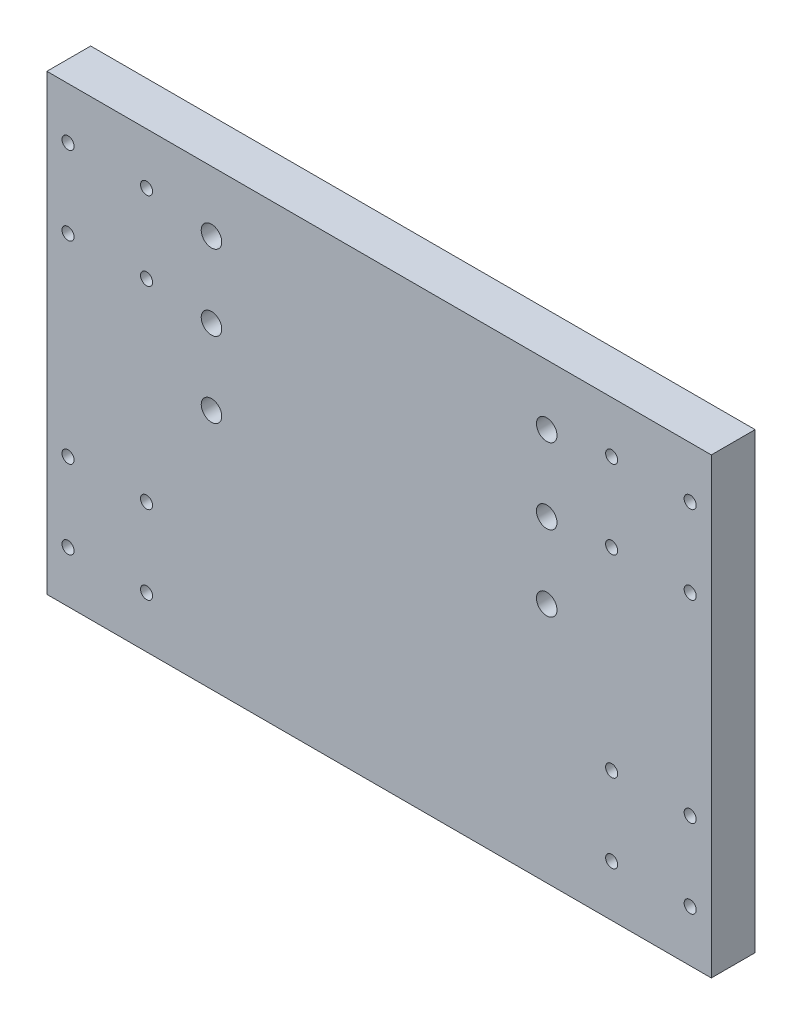
from build123d import *

# Parameters (mm, degrees)
ESQUISSE1_W                  = 220
ESQUISSE1_H                  = 150
BOSS_EXTRU_1_DEPTH           = 14.5
ENL_V_MAT_EXTRU_1_DEPTH      = 267.665052078
ENL_V_MAT_EXTRU_1_DEPTH_BACK = 267.665052078
ESQUISSE2_R                  = 2
ESQUISSE3_R                  = 4
ENL_V_MAT_EXTRU_2_DEPTH      = 4
ENL_V_MAT_EXTRU_3_DEPTH      = 267.665052078
ENL_V_MAT_EXTRU_3_DEPTH_BACK = 267.665052078
ESQUISSE4_R                  = 3.4


with BuildPart() as part:
    # Esquisse1 → Boss.-Extru.1 (new body)
    with BuildSketch(Plane.XY):
        with Locations((110, 75)):
            Rectangle(ESQUISSE1_W, ESQUISSE1_H)
    extrude(amount=BOSS_EXTRU_1_DEPTH)

    # Esquisse2 → Enlèv. mat.-Extru.1 (cut, two sides: drawn at the far end of the back side and taken through both)
    with BuildSketch(Plane.XY.offset(14.5).offset(-ENL_V_MAT_EXTRU_1_DEPTH_BACK)):
        with Locations((33, 43)):
            Circle(ESQUISSE2_R)
        with Locations((33, 17)):
            Circle(ESQUISSE2_R)
        with Locations((7, 17)):
            Circle(ESQUISSE2_R)
        with Locations((7, 43)):
            Circle(ESQUISSE2_R)
        with Locations((213, 43)):
            Circle(ESQUISSE2_R)
        with Locations((213, 17)):
            Circle(ESQUISSE2_R)
        with Locations((187, 17)):
            Circle(ESQUISSE2_R)
        with Locations((187, 43)):
            Circle(ESQUISSE2_R)
        with Locations((187, 107)):
            Circle(ESQUISSE2_R)
        with Locations((187, 133)):
            Circle(ESQUISSE2_R)
        with Locations((213, 133)):
            Circle(ESQUISSE2_R)
        with Locations((213, 107)):
            Circle(ESQUISSE2_R)
        with Locations((7, 107)):
            Circle(ESQUISSE2_R)
        with Locations((7, 133)):
            Circle(ESQUISSE2_R)
        with Locations((33, 133)):
            Circle(ESQUISSE2_R)
        with Locations((33, 107)):
            Circle(ESQUISSE2_R)
    extrude(amount=ENL_V_MAT_EXTRU_1_DEPTH + ENL_V_MAT_EXTRU_1_DEPTH_BACK, mode=Mode.SUBTRACT)

    # Esquisse3 → Enlèv. mat.-Extru.2 (cut)
    with BuildSketch(Plane.XY):
        with Locations((7, 17)):
            Circle(ESQUISSE3_R)
        with Locations((33, 17)):
            Circle(ESQUISSE3_R)
        with Locations((33, 43)):
            Circle(ESQUISSE3_R)
        with Locations((7, 43)):
            Circle(ESQUISSE3_R)
        with Locations(Location((213, 43, 0), (0, 0, 180))):
            Circle(ESQUISSE3_R)
        with Locations(Location((187, 43, 0), (0, 0, 180))):
            Circle(ESQUISSE3_R)
        with Locations(Location((187, 17, 0), (0, 0, 180))):
            Circle(ESQUISSE3_R)
        with Locations(Location((213, 17, 0), (0, 0, 180))):
            Circle(ESQUISSE3_R)
        with Locations((213, 133)):
            Circle(ESQUISSE3_R)
        with Locations((187, 133)):
            Circle(ESQUISSE3_R)
        with Locations((187, 107)):
            Circle(ESQUISSE3_R)
        with Locations((213, 107)):
            Circle(ESQUISSE3_R)
        with Locations(Location((7, 107, 0), (0, 0, 180))):
            Circle(ESQUISSE3_R)
        with Locations(Location((33, 107, 0), (0, 0, 180))):
            Circle(ESQUISSE3_R)
        with Locations(Location((33, 133, 0), (0, 0, 180))):
            Circle(ESQUISSE3_R)
        with Locations(Location((7, 133, 0), (0, 0, 180))):
            Circle(ESQUISSE3_R)
    extrude(amount=ENL_V_MAT_EXTRU_2_DEPTH, mode=Mode.SUBTRACT)

    # Esquisse4 → Enlèv. mat.-Extru.3 (cut, two sides: drawn at the far end of the back side and taken through both)
    with BuildSketch(Plane(origin=(0, 0, 0), x_dir=(-1, 0, 0), z_dir=(0, 0, -1)).offset(-ENL_V_MAT_EXTRU_3_DEPTH_BACK)):
        with Locations((-165.5, 130)):
            Circle(ESQUISSE4_R)
        with Locations((-165.5, 105)):
            Circle(ESQUISSE4_R)
        with Locations((-165.5, 80)):
            Circle(ESQUISSE4_R)
        with Locations((-54.5, 80)):
            Circle(ESQUISSE4_R)
        with Locations((-54.5, 105)):
            Circle(ESQUISSE4_R)
        with Locations((-54.5, 130)):
            Circle(ESQUISSE4_R)
    extrude(amount=ENL_V_MAT_EXTRU_3_DEPTH + ENL_V_MAT_EXTRU_3_DEPTH_BACK, mode=Mode.SUBTRACT)


solid = part.part
